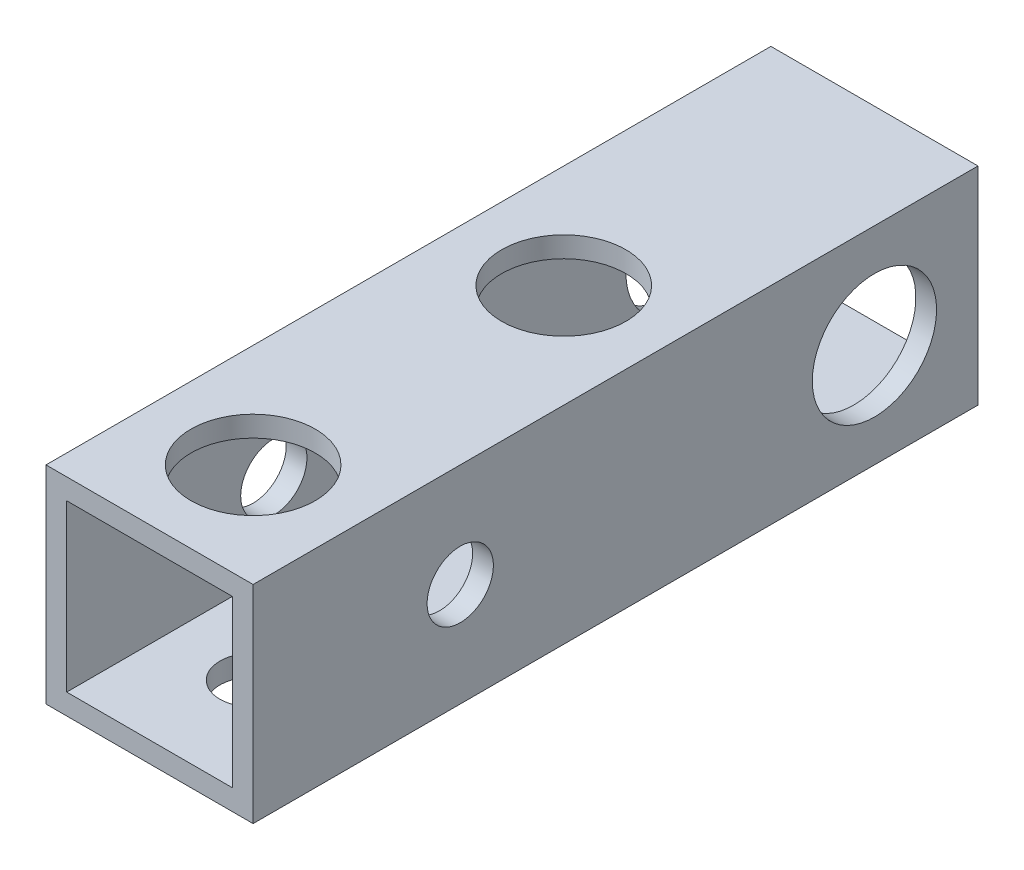
from build123d import *

# Parameters (mm, degrees)
SKETCH_1_W          = 10
SKETCH_1_H          = 10
SKETCH_1_W_2        = 8
SKETCH_1_H_2        = 8
EXTRUDE_1_DEPTH     = 80
SKETCH_2_R          = 3
CUT_EXTRUDE_1_DEPTH = 81.777472107
SKETCH_3_R          = 3
CUT_EXTRUDE_2_DEPTH = 10
SKETCH_4_R          = 1.6
CUT_EXTRUDE_3_DEPTH = 10
SKETCH_5_R          = 1.6
CUT_EXTRUDE_4_DEPTH = 81.777472107
SKETCH_6_W          = 10
SKETCH_6_H          = 45
CUT_EXTRUDE_5_DEPTH = 10
SKETCH_7_R          = 3
CUT_EXTRUDE_6_DEPTH = 2


with BuildPart() as part:
    # ｽｹｯﾁ1 → ﾎﾞｽ - 押し出し1 (new body)
    with BuildSketch(Plane.XY):
        Rectangle(SKETCH_1_W, SKETCH_1_H)
        Rectangle(SKETCH_1_W_2, SKETCH_1_H_2, mode=Mode.SUBTRACT)
    extrude(amount=EXTRUDE_1_DEPTH)

    # ｽｹｯﾁ2 → ｶｯﾄ - 押し出し1 (cut, through all)
    with BuildSketch(Plane.ZY.offset(5)):
        with Locations((5, 0)):
            Circle(SKETCH_2_R)
        with Locations((75, 0)):
            Circle(SKETCH_2_R)
    extrude(amount=-CUT_EXTRUDE_1_DEPTH, mode=Mode.SUBTRACT)

    # ｽｹｯﾁ3 → ｶｯﾄ - 押し出し2 (cut)
    with BuildSketch(Plane(origin=(0, 5, 0), x_dir=(1, 0, 0), z_dir=(0, 1, 0))):
        with Locations(Location((0, -65, 0), (0, 0, 270))):
            Circle(SKETCH_3_R)
        with Locations(Location((0, -15, 0), (0, 0, 270))):
            Circle(SKETCH_3_R)
    extrude(amount=-CUT_EXTRUDE_2_DEPTH, mode=Mode.SUBTRACT)

    # ｽｹｯﾁ4 → ｶｯﾄ - 押し出し3 (cut)
    with BuildSketch(Plane(origin=(0, 5, 0), x_dir=(1, 0, 0), z_dir=(0, 1, 0))):
        with Locations(Location((0, -30, 0), (0, 0, 270))):
            Circle(SKETCH_4_R)
        with Locations(Location((0, -50, 0), (0, 0, 270))):
            Circle(SKETCH_4_R)
    extrude(amount=-CUT_EXTRUDE_3_DEPTH, mode=Mode.SUBTRACT)

    # ｽｹｯﾁ5 → ｶｯﾄ - 押し出し4 (cut, through all)
    with BuildSketch(Plane.ZY.offset(5)):
        with Locations((25, 0)):
            Circle(SKETCH_5_R)
        with Locations((55, 0)):
            Circle(SKETCH_5_R)
    extrude(amount=-CUT_EXTRUDE_4_DEPTH, mode=Mode.SUBTRACT)

    # ｽｹｯﾁ6 → ｶｯﾄ - 押し出し5 (cut)
    with BuildSketch(Plane(origin=(0, 5, 0), x_dir=(1, 0, 0), z_dir=(0, 1, 0))):
        with Locations((0, -57.5)):
            Rectangle(SKETCH_6_W, SKETCH_6_H)
    extrude(amount=-CUT_EXTRUDE_5_DEPTH, mode=Mode.SUBTRACT)

    # ｽｹｯﾁ7 → ｶｯﾄ - 押し出し6 (cut)
    with BuildSketch(Plane(origin=(0, 5, 0), x_dir=(1, 0, 0), z_dir=(0, 1, 0))):
        with Locations(Location((0, -30, 0), (0, 0, 270))):
            Circle(SKETCH_7_R)
    extrude(amount=-CUT_EXTRUDE_6_DEPTH, mode=Mode.SUBTRACT)


solid = part.part
